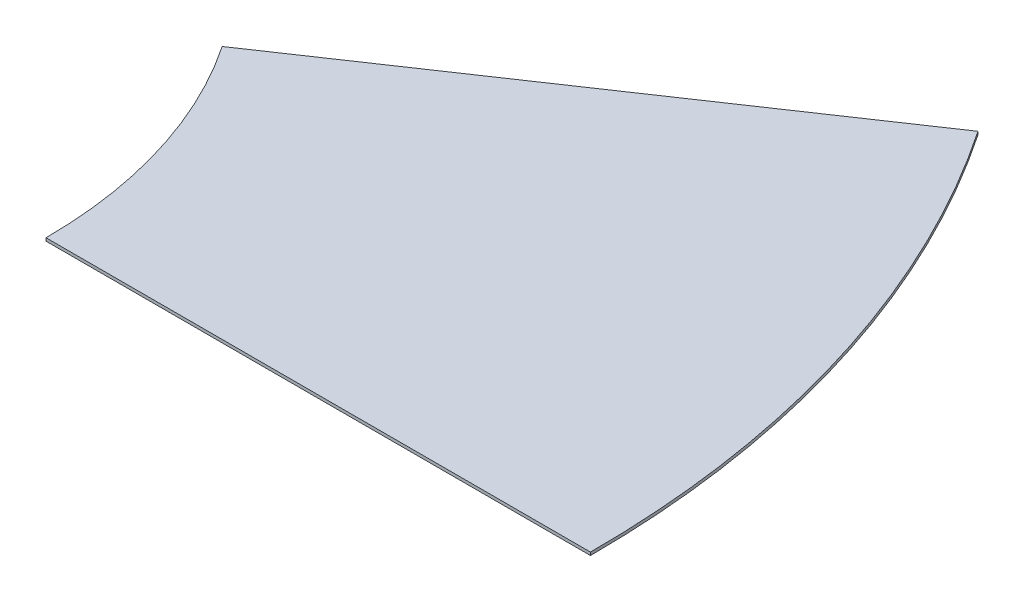
from build123d import *

# Parameters (mm, degrees)
EXTRUDE_1_DEPTH = 0.33


with BuildPart() as part:
    # 草图1 → 凸台-拉伸1 (new body)
    with BuildSketch(Plane(origin=(0, 0, 0), x_dir=(1, 0, 0), z_dir=(0, 1, 0))):
        with BuildLine():
            Line((91.194132981, 61.511219382), (41.451878628, 27.959645174))
            ThreePointArc((41.451878628, 27.959645174), (47.815237798, 14.618585236), (50, 0))
            Line((50, 0), (110, 0))
            ThreePointArc((110, 0), (105.193523156, 32.16088752), (91.194132981, 61.511219382))
        make_face()
    extrude(amount=EXTRUDE_1_DEPTH)


solid = part.part
